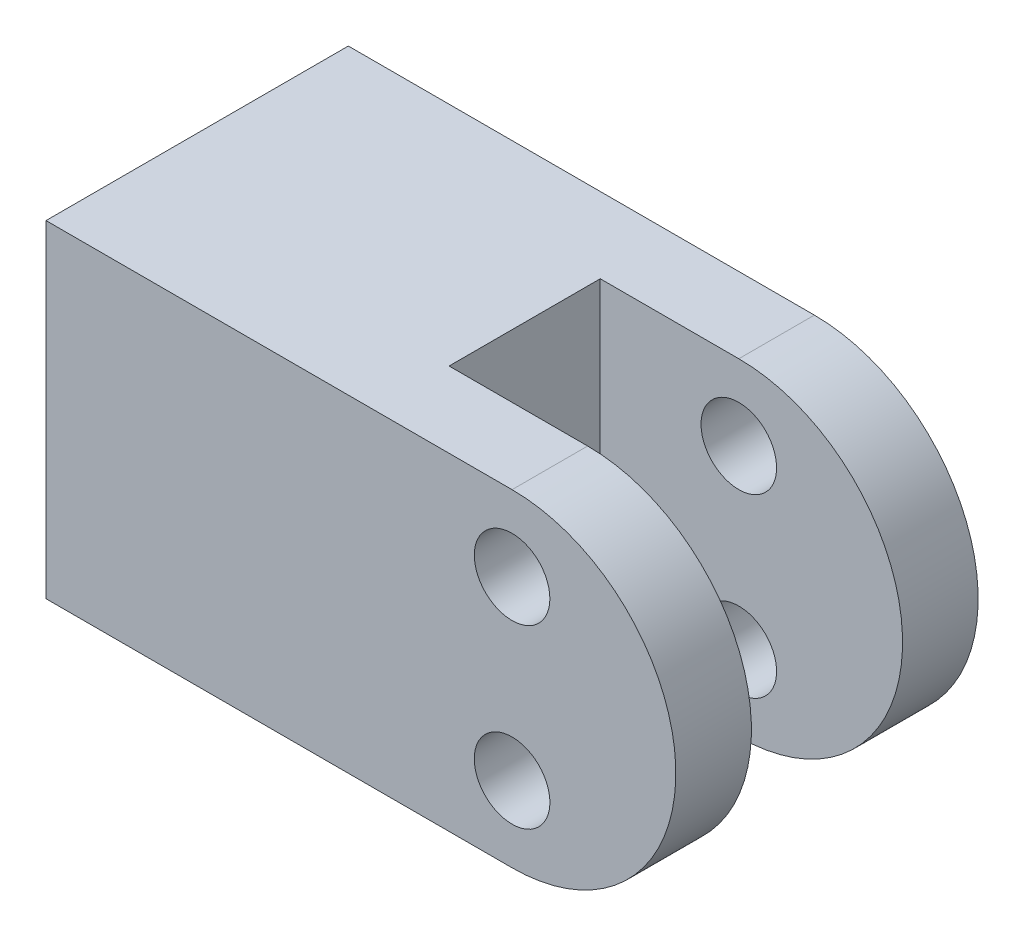
from build123d import *

# Parameters (mm, degrees)
SKETCH1_R               = 1.5
BOSS_EXTRUDE1_DEPTH     = 6
CUT_EXTRUDE1_DEPTH      = 21.506096654
CUT_EXTRUDE1_DEPTH_BACK = 21.506096654
SKETCH2_W               = 12
SKETCH2_H               = 6
SKETCH3_R               = 2
CUT_EXTRUDE2_DEPTH      = 10


with BuildPart() as part:
    # Sketch1 → Boss-Extrude1 (new, symmetric)
    with BuildSketch(Plane.XY):
        with BuildLine():
            Line((-18.5, 6.5), (0, 6.5))
            ThreePointArc((0, 6.5), (6.5, 0), (0, -6.5))
            Line((0, -6.5), (-18.5, -6.5))
            Line((-18.5, -6.5), (-18.5, 6.5))
        make_face()
        with Locations((0, 3.5)):
            Circle(SKETCH1_R, mode=Mode.SUBTRACT)
        with Locations(Location((0, -3.5, 0), (0, 0, 180))):
            Circle(SKETCH1_R, mode=Mode.SUBTRACT)
    extrude(amount=BOSS_EXTRUDE1_DEPTH, both=True)

    # Sketch2 → Cut-Extrude1 (cut, two sides: drawn at the far end of the back side and taken through both)
    with BuildSketch(Plane(origin=(0, 0, 0), x_dir=(1, 0, 0), z_dir=(0, 1, 0)).offset(-CUT_EXTRUDE1_DEPTH_BACK)):
        with Locations((0.5, 0)):
            Rectangle(SKETCH2_W, SKETCH2_H)
    extrude(amount=CUT_EXTRUDE1_DEPTH + CUT_EXTRUDE1_DEPTH_BACK, mode=Mode.SUBTRACT)

    # Sketch3 → Cut-Extrude2 (cut)
    with BuildSketch(Plane.ZY.offset(18.5)):
        Circle(SKETCH3_R)
    extrude(amount=-CUT_EXTRUDE2_DEPTH, mode=Mode.SUBTRACT)


solid = part.part
